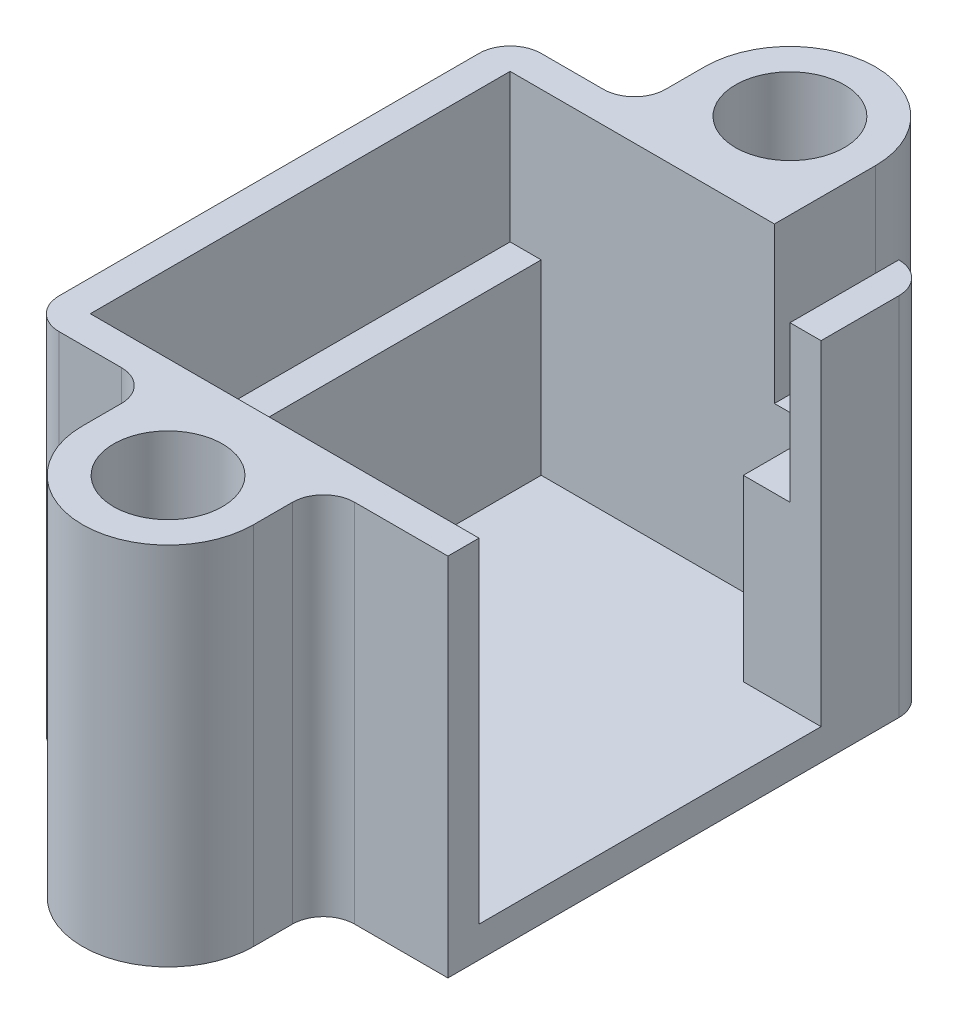
from build123d import *

# Parameters (mm, degrees)
SKETCH1_W           = 13.5
SKETCH1_H           = 15.5
SKETCH1_W_2         = 11.5
SKETCH1_H_2         = 13.5
BOSS_EXTRUDE1_DEPTH = 1
BOSS_EXTRUDE2_DEPTH = 10.75
SKETCH3_W           = 3
SKETCH3_H           = 1
CUT_EXTRUDE1_DEPTH  = 5
SKETCH4_R           = 1.75
BOSS_EXTRUDE3_DEPTH = 11.75
FILLET1_R           = 1
SKETCH5_W           = 1
SKETCH5_H           = 13.5
BOSS_EXTRUDE4_DEPTH = 6
SKETCH6_W           = 1.5
SKETCH6_H           = 2.5
BOSS_EXTRUDE5_DEPTH = 5.75


with BuildPart() as part:
    # Sketch1 → Boss-Extrude1 (new body)
    # profile 1 of 2: a face of its own
    with BuildSketch(Plane(origin=(0, 0, 0), x_dir=(1, 0, 0), z_dir=(0, 1, 0))):
        Rectangle(SKETCH1_W, SKETCH1_H)
        Rectangle(SKETCH1_W_2, SKETCH1_H_2, mode=Mode.SUBTRACT)
    # profile 2 of 2: a face of its own
    with BuildSketch(Plane(origin=(0, 0, 0), x_dir=(1, 0, 0), z_dir=(0, 1, 0))):
        Rectangle(SKETCH1_W_2, SKETCH1_H_2)
    extrude(amount=BOSS_EXTRUDE1_DEPTH)

    # Sketch2 → Boss-Extrude2 (add)
    with BuildSketch(Plane(origin=(0, 1, 0), x_dir=(1, 0, 0), z_dir=(0, 1, 0))):
        Polygon((-6.75, -7.75), (6.75, -7.75), (6.75, -6.75), (5.75, -6.75), (-5.75, -6.75), (-5.75, 6.75), (5.75, 6.75), (5.75, 4.25), (6.75, 4.25), (6.75, 7.75), (-6.75, 7.75), align=None)
    extrude(amount=BOSS_EXTRUDE2_DEPTH)

    # Sketch3 → Cut-Extrude1 (cut)
    with BuildSketch(Plane(origin=(0, 11.75, 0), x_dir=(1, 0, 0), z_dir=(0, 1, 0))):
        with Locations((4.25, 7.25)):
            Rectangle(SKETCH3_W, SKETCH3_H)
    extrude(amount=-CUT_EXTRUDE1_DEPTH, mode=Mode.SUBTRACT)

    # Sketch4 → Boss-Extrude3 (add)
    # profile 1 of 6: a face of its own
    with BuildSketch(Plane(origin=(0, 11.75, 0), x_dir=(1, 0, 0), z_dir=(0, 1, 0))):
        with BuildLine():
            ThreePointArc((2.75, 10), (0, 12.75), (-2.75, 10))
            ThreePointArc((-2.75, 10), (-2.440351592, 8.732252348), (-1.58113883, 7.75))
            Line((-1.58113883, 7.75), (1.58113883, 7.75))
            ThreePointArc((1.58113883, 7.75), (2.440351592, 8.732252348), (2.75, 10))
        make_face()
        with Locations(Location((0, 10, 0), (0, 0, 270))):
            Circle(SKETCH4_R, mode=Mode.SUBTRACT)
    # profile 2 of 6: a face of its own
    with BuildSketch(Plane(origin=(0, 11.75, 0), x_dir=(1, 0, 0), z_dir=(0, 1, 0))):
        with BuildLine():
            ThreePointArc((-1.58113883, 7.75), (-2.440351592, 8.732252348), (-2.75, 10))
            Line((-2.75, 10), (-2.75, 7.75))
            Line((-2.75, 7.75), (-1.58113883, 7.75))
        make_face()
    # profile 3 of 6: a face of its own
    with BuildSketch(Plane(origin=(0, 11.75, 0), x_dir=(1, 0, 0), z_dir=(0, 1, 0))):
        with BuildLine():
            Line((2.75, 7.75), (2.75, 10))
            ThreePointArc((2.75, 10), (2.440351592, 8.732252348), (1.58113883, 7.75))
            Line((1.58113883, 7.75), (2.75, 7.75))
        make_face()
    # profile 4 of 6: a face of its own
    with BuildSketch(Plane(origin=(0, 11.75, 0), x_dir=(1, 0, 0), z_dir=(0, 1, 0))):
        with BuildLine():
            Line((-2.75, -7.75), (-2.75, -10))
            ThreePointArc((-2.75, -10), (-2.440351592, -8.732252348), (-1.58113883, -7.75))
            Line((-1.58113883, -7.75), (-2.75, -7.75))
        make_face()
    # profile 5 of 6: a face of its own
    with BuildSketch(Plane(origin=(0, 11.75, 0), x_dir=(1, 0, 0), z_dir=(0, 1, 0))):
        with BuildLine():
            ThreePointArc((-1.58113883, -7.75), (-2.440351592, -8.732252348), (-2.75, -10))
            ThreePointArc((-2.75, -10), (0, -12.75), (2.75, -10))
            ThreePointArc((2.75, -10), (2.440351592, -8.732252348), (1.58113883, -7.75))
            Line((1.58113883, -7.75), (-1.58113883, -7.75))
        make_face()
        with Locations(Location((0, -10, 0), (0, 0, 270))):
            Circle(SKETCH4_R, mode=Mode.SUBTRACT)
    # profile 6 of 6: a face of its own
    with BuildSketch(Plane(origin=(0, 11.75, 0), x_dir=(1, 0, 0), z_dir=(0, 1, 0))):
        with BuildLine():
            ThreePointArc((1.58113883, -7.75), (2.440351592, -8.732252348), (2.75, -10))
            Line((2.75, -10), (2.75, -7.75))
            Line((2.75, -7.75), (1.58113883, -7.75))
        make_face()
    extrude(amount=-BOSS_EXTRUDE3_DEPTH)

    # Fillet1
    fillet1_edges = [part.edges().sort_by_distance(p)[0] for p in [
        (-2.75, 5.875, -7.75),
        (2.75, 3.375, -7.75),
        (-2.75, 5.875, 7.75),
        (2.75, 5.875, 7.75),
        (-6.75, 5.875, 7.75),
        (-6.75, 5.875, -7.75),
        (6.75, 5.875, -7.75),
    ]]
    fillet(fillet1_edges, radius=FILLET1_R)

    # Sketch5 → Boss-Extrude4 (add)
    with BuildSketch(Plane(origin=(0, 1, 0), x_dir=(1, 0, 0), z_dir=(0, 1, 0))):
        with Locations((-5.25, 0)):
            Rectangle(SKETCH5_W, SKETCH5_H)
    extrude(amount=BOSS_EXTRUDE4_DEPTH)

    # Sketch6 → Boss-Extrude5 (add)
    with BuildSketch(Plane(origin=(0, 1, 0), x_dir=(1, 0, 0), z_dir=(0, 1, 0))):
        with Locations((5, 5.5)):
            Rectangle(SKETCH6_W, SKETCH6_H)
    extrude(amount=BOSS_EXTRUDE5_DEPTH)


solid = part.part
